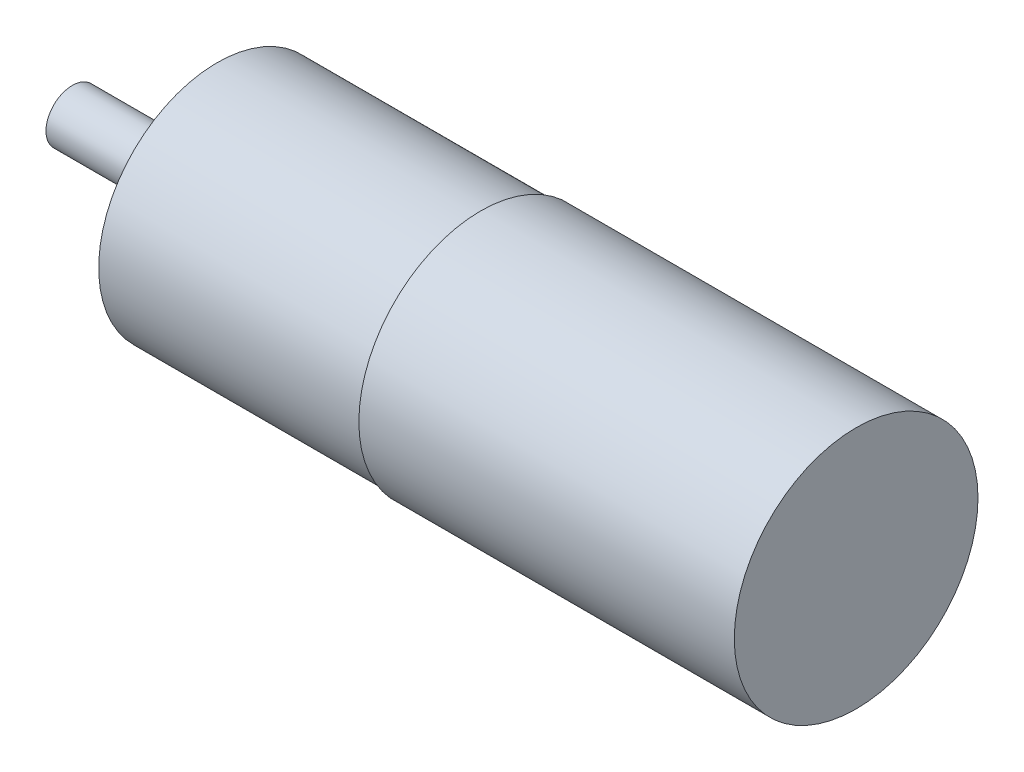
from build123d import *

# Parameters (mm, degrees)
SKETCH_1_R               = 18
EXTRUDE_1_DEPTH          = 40
SKETCH_2_R               = 11
EXTRUDE_2_DEPTH          = 2
SKETCH_3_R               = 4
EXTRUDE_3_DEPTH          = 20
SKETCH_4_R               = 1.5
CUT_EXTRUDE_1_DEPTH      = 5
PATTERN_CIRCULAR_1_COUNT = 4
CUT_EXTRUDE_START        = -15
CUT_EXTRUDE_2_DEPTH      = 15
SKETCH_6_R               = 18.5
EXTRUDE_4_DEPTH          = 57


with BuildPart() as part:
    # 草图1 → 凸台-拉伸1 (new body)
    with BuildSketch(Plane(origin=(0, 0, 0), x_dir=(0, 0, -1), z_dir=(1, 0, 0))):
        Circle(SKETCH_1_R)
    extrude(amount=EXTRUDE_1_DEPTH)

    # 草图2 → 凸台-拉伸2 (add)
    with BuildSketch(Plane.ZY):
        Circle(SKETCH_2_R)
    extrude(amount=EXTRUDE_2_DEPTH)

    # 草图3 → 凸台-拉伸3 (add)
    with BuildSketch(Plane.ZY.offset(2)):
        Circle(SKETCH_3_R)
    extrude(amount=EXTRUDE_3_DEPTH)

    # 草图4 → 切除-拉伸1 (cut)
    with BuildSketch(Plane.ZY):
        with Locations((-14, 0)):
            Circle(SKETCH_4_R)
    cut_extrude_1 = extrude(amount=-CUT_EXTRUDE_1_DEPTH, mode=Mode.SUBTRACT)

    # 阵列(圆周)1: 切除-拉伸1 ×4 about axis
    pattern_circular_1_axis = Axis((0, 0, 0), (1, 0, 0))
    for i in range(1, PATTERN_CIRCULAR_1_COUNT):
        add(cut_extrude_1.rotate(pattern_circular_1_axis, i * 360 / PATTERN_CIRCULAR_1_COUNT), mode=Mode.SUBTRACT)

    # 草图5 → 切除-拉伸2 (cut)
    with BuildSketch(Plane.ZY.offset(22).offset(CUT_EXTRUDE_START)):
        with BuildLine():
            Line((-3.773069257, -1.328137186), (1.382044823, -3.753658496))
            ThreePointArc((1.382044823, -3.753658496), (-1.702949755, -3.619386983), (-3.773069257, -1.328137186))
        make_face()
    extrude(amount=CUT_EXTRUDE_2_DEPTH, mode=Mode.SUBTRACT)

    # 草图6 → 凸台-拉伸4 (add)
    with BuildSketch(Plane(origin=(40, 0, 0), x_dir=(0, 0, -1), z_dir=(1, 0, 0))):
        with Locations(Location((0, 0, 0), (0, 0, 180))):
            Circle(SKETCH_6_R)
    extrude(amount=EXTRUDE_4_DEPTH)


solid = part.part
